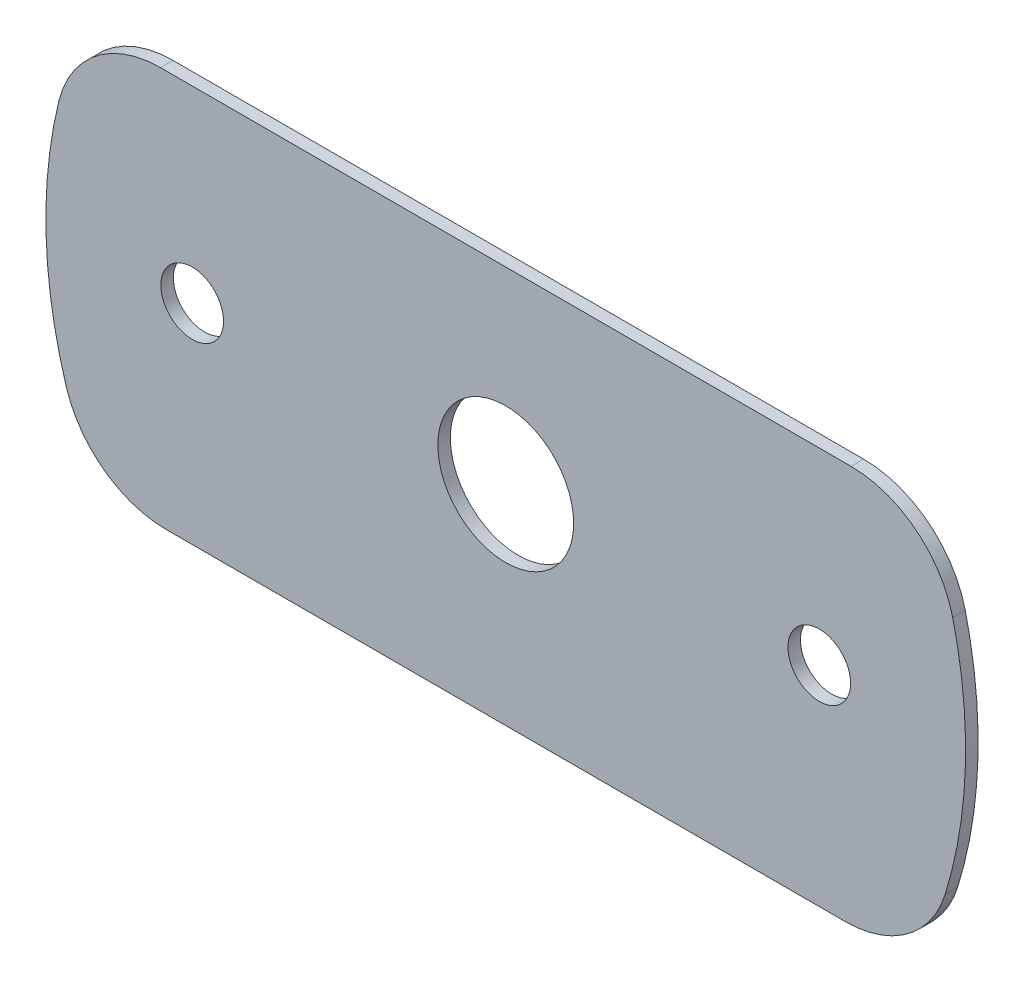
from build123d import *

# Parameters (mm, degrees)
SKETCH_1_R          = 22
EXTRUDE_1_DEPTH     = 0.6
SKETCH_2_R          = 3.25
CUT_EXTRUDE_1_DEPTH = 32.118483254
SKETCH_3_R          = 1.5
CUT_EXTRUDE_2_DEPTH = 32.118483254
SKETCH_5_W          = 56.096765119
SKETCH_5_H          = 19.515049226
SKETCH_5_W_2        = 56.672855133
SKETCH_5_H_2        = 21.675386779
CUT_EXTRUDE_4_DEPTH = 32.118483254
FILLET_1_R          = 5


with BuildPart() as part:
    # Эскиз1 → Бобышка-Вытянуть1 (new body)
    with BuildSketch(Plane.XY):
        Circle(SKETCH_1_R)
    extrude(amount=EXTRUDE_1_DEPTH)

    # Эскиз2 → Вырез-Вытянуть1 (cut, through all)
    with BuildSketch(Plane.XY.offset(0.6)):
        Circle(SKETCH_2_R)
    extrude(amount=-CUT_EXTRUDE_1_DEPTH, mode=Mode.SUBTRACT)

    # Эскиз3 → Вырез-Вытянуть2 (cut, through all)
    with BuildSketch(Plane.XY.offset(0.6)):
        with Locations((-15, 0)):
            Circle(SKETCH_3_R)
        with Locations((15, 0)):
            Circle(SKETCH_3_R)
    extrude(amount=-CUT_EXTRUDE_2_DEPTH, mode=Mode.SUBTRACT)

    # Эскиз5 → Вырез-Вытянуть4 (cut, through all)
    with BuildSketch(Plane.XY.offset(0.6)):
        with Locations((0.108016877, 18.757524613)):
            Rectangle(SKETCH_5_W, SKETCH_5_H)
        with Locations((0.396061884, -20.83769339)):
            Rectangle(SKETCH_5_W_2, SKETCH_5_H_2)
    extrude(amount=-CUT_EXTRUDE_4_DEPTH, mode=Mode.SUBTRACT)

    # Скругление1
    fillet_1_edges = [part.edges().sort_by_distance(p)[0] for p in [
        (-20.0748599, 9, 0.3),
        (20.0748599, 9, 0.3),
        (19.595917942, -10, 0.3),
        (-19.595917942, -10, 0.3),
    ]]
    fillet(fillet_1_edges, radius=FILLET_1_R)


solid = part.part
